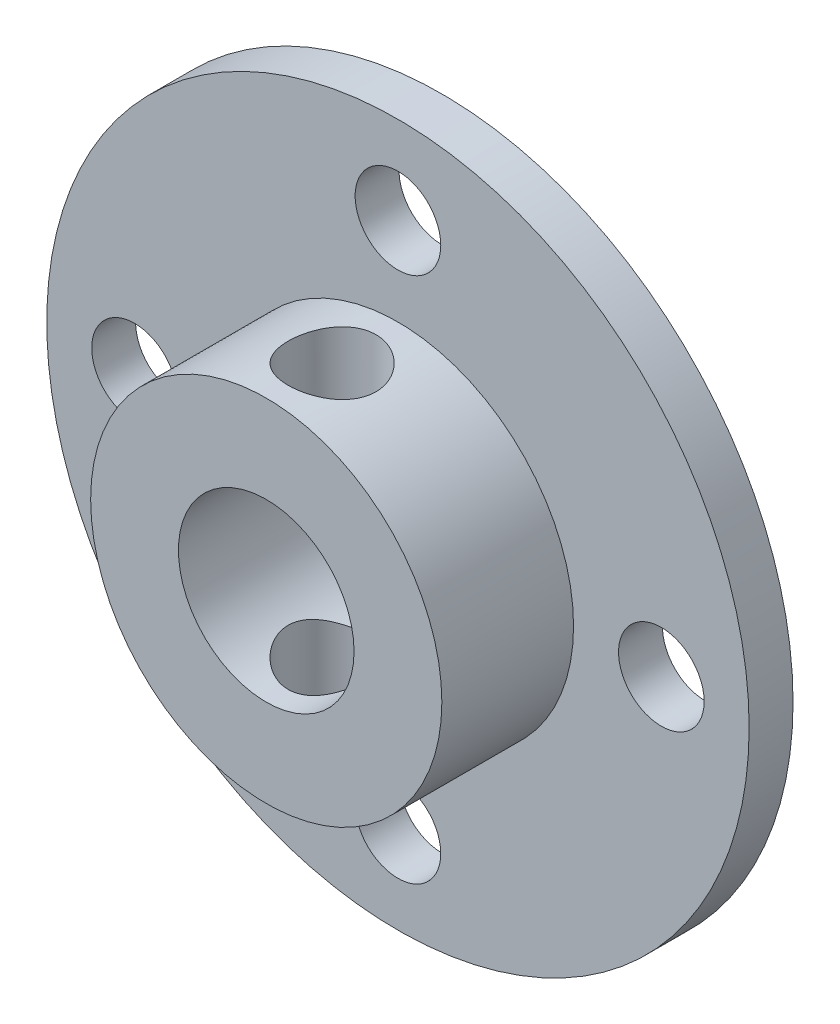
from build123d import *

# Parameters (mm, degrees)
SKETCH1_R           = 8
SKETCH1_R_2         = 4
BOSS_EXTRUDE1_DEPTH = 8
SKETCH2_R           = 16
SKETCH2_R_2         = 1.95
BOSS_EXTRUDE2_DEPTH = 2
SKETCH3_R           = 2
CUT_EXTRUDE1_DEPTH  = 10


with BuildPart() as part:
    # Sketch1 → Boss-Extrude1 (new body)
    with BuildSketch(Plane.XY):
        Circle(SKETCH1_R)
        Circle(SKETCH1_R_2, mode=Mode.SUBTRACT)
    extrude(amount=BOSS_EXTRUDE1_DEPTH)

    # Sketch2 → Boss-Extrude2 (add)
    with BuildSketch(Plane.XY):
        Circle(SKETCH2_R)
        with Locations((12, 0)):
            Circle(SKETCH2_R_2, mode=Mode.SUBTRACT)
        with Locations((0, -12)):
            Circle(SKETCH2_R_2, mode=Mode.SUBTRACT)
        with Locations((-12, 0)):
            Circle(SKETCH2_R_2, mode=Mode.SUBTRACT)
        with Locations((0, 12)):
            Circle(SKETCH2_R_2, mode=Mode.SUBTRACT)
    extrude(amount=BOSS_EXTRUDE2_DEPTH)

    # Sketch3 → Cut-Extrude1 (cut, symmetric)
    with BuildSketch(Plane(origin=(0, 0, 0), x_dir=(1, 0, 0), z_dir=(0, 1, 0))):
        with Locations(Location((0, -5, 0), (0, 0, 270))):
            Circle(SKETCH3_R)
    extrude(amount=CUT_EXTRUDE1_DEPTH, both=True, mode=Mode.SUBTRACT)


solid = part.part
